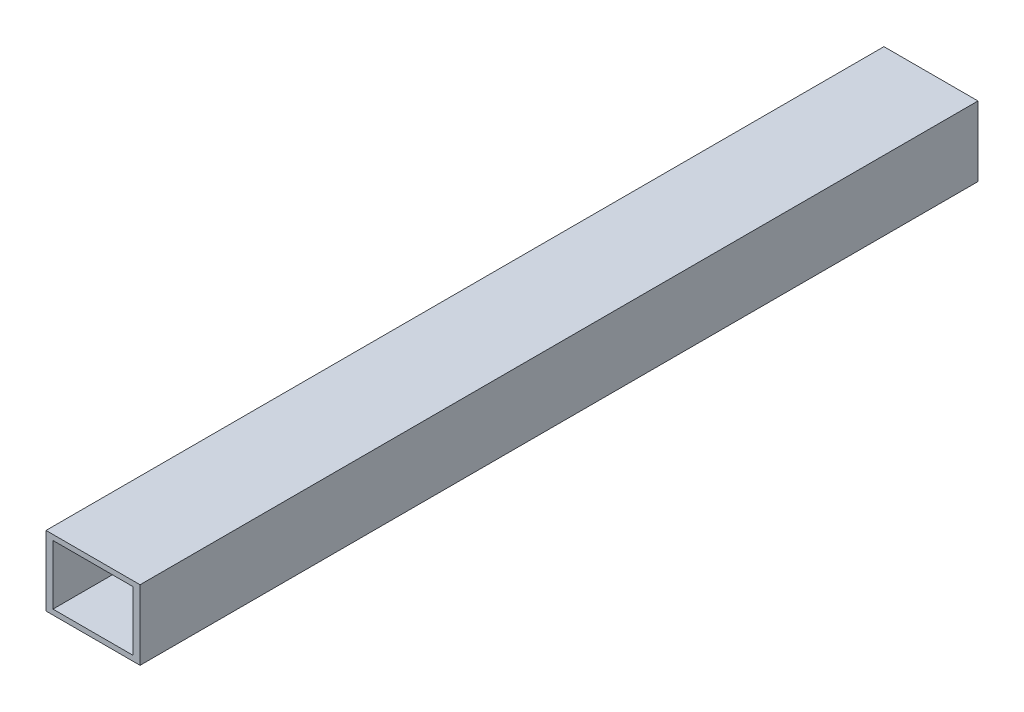
from build123d import *

# Parameters (mm, degrees)
SKETCH1_W           = 68.428236542
SKETCH1_H           = 50.8
SKETCH1_W_2         = 58.268236542
SKETCH1_H_2         = 43.25738271
BOSS_EXTRUDE1_DEPTH = 609.6


with BuildPart() as part:
    # Sketch1 → Boss-Extrude1 (new body)
    with BuildSketch(Plane.XY):
        Rectangle(SKETCH1_W, SKETCH1_H)
        Rectangle(SKETCH1_W_2, SKETCH1_H_2, mode=Mode.SUBTRACT)
    extrude(amount=BOSS_EXTRUDE1_DEPTH)


solid = part.part
